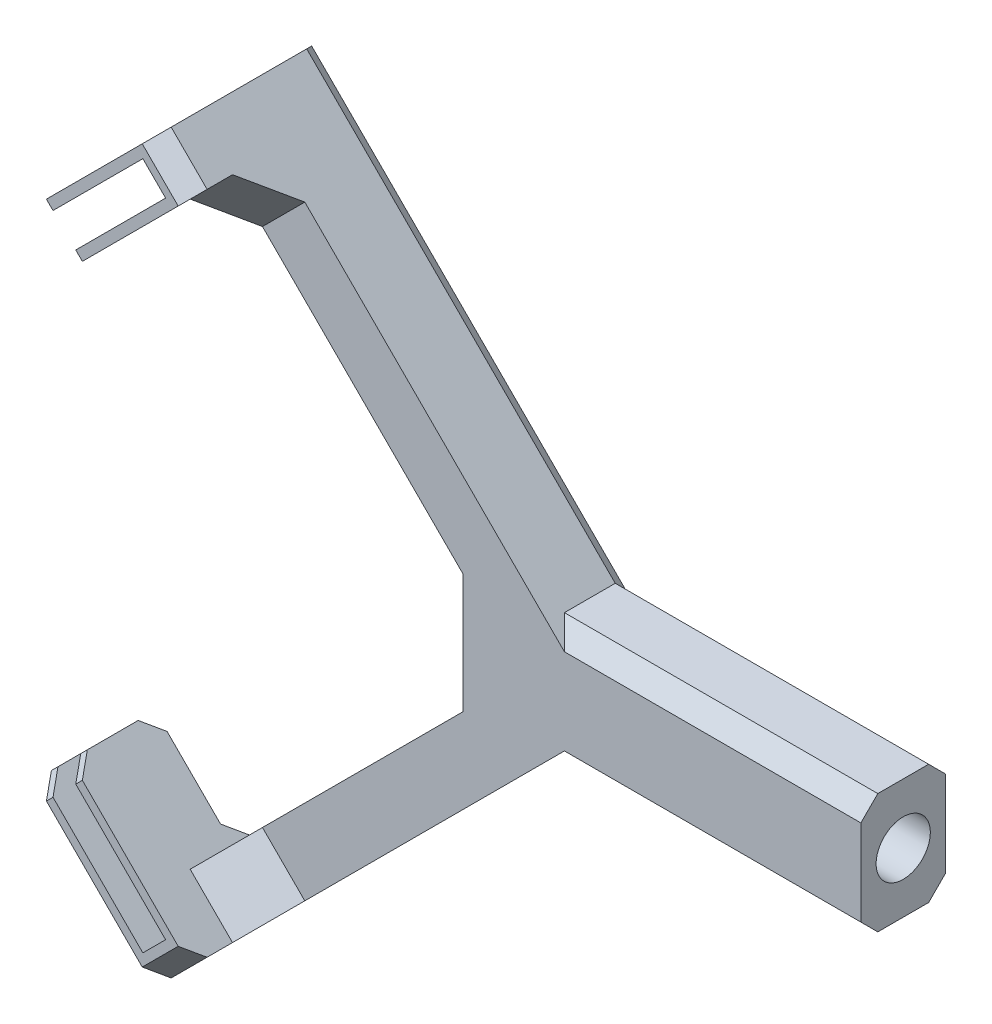
from build123d import *

# Parameters (mm, degrees)
EXTRUDE_1_DEPTH          = 5
CHAMFER_1_SIZE           = 10
CUT_EXTRUDE_1_DEPTH      = 61.279402969
CUT_EXTRUDE_1_DEPTH_BACK = 61.279402969
SKETCH_2_R               = 2.1
EXTRUDE_START            = 37
SKETCH_3_W               = 10
SKETCH_3_H               = 14.142135624
SKETCH_3_R               = 2.1
EXTRUDE_2_DEPTH          = 37
SKETCH_4_W               = 10
SKETCH_4_H               = 20
EXTRUDE_3_DEPTH          = 6
SKETCH_6_W               = 10
SKETCH_6_H               = 32
EXTRUDE_5_DEPTH          = 6
CUT_EXTRUDE_2_DEPTH      = 15
CUT_EXTRUDE_3_DEPTH      = 72.219678224
SKETCH_10_W              = 15
SKETCH_10_H              = 3.8
EXTRUDE_6_DEPTH          = 3
CHAMFER_2_SIZE           = 2
CHAMFER_3_SIZE           = 2
CHAMFER_4_SIZE           = 5
CHAMFER_5_SIZE           = 2
SKETCH_12_R              = 3.2
CUT_EXTRUDE_4_DEPTH      = 38
CUT_EXTRUDE_5_DEPTH      = 4


with BuildPart() as part:
    # 草图1 → 凸台-拉伸1 (new, symmetric)
    with BuildSketch(Plane.XY):
        Polygon((-10, 0), (33.5, 43.5), (38.5, 38.5), (0, 0), (38.5, -38.5), (33.5, -43.5), align=None)
    extrude(amount=EXTRUDE_1_DEPTH, both=True)

    # 倒角1
    chamfer_1_edges = [part.edges().sort_by_distance(p)[0] for p in [
        (-10, 0, 0),
        (0, 0, 0),
    ]]
    chamfer(chamfer_1_edges, length=CHAMFER_1_SIZE)

    # 草图2 → 切除-拉伸1 (cut, two sides: drawn at the far end of the back side and taken through both)
    with BuildSketch(Plane.ZY.offset(2.928932188).offset(-CUT_EXTRUDE_1_DEPTH_BACK)):
        with Locations(Location((0, 0, 0), (0, 0, 270))):
            Circle(SKETCH_2_R)
    extrude(amount=CUT_EXTRUDE_1_DEPTH + CUT_EXTRUDE_1_DEPTH_BACK, mode=Mode.SUBTRACT)

    # 草图3 → 凸台-拉伸2 (add)
    with BuildSketch(Plane.ZY.offset(2.928932188).offset(EXTRUDE_START)):
        Rectangle(SKETCH_3_W, SKETCH_3_H)
        with Locations(Location((0, 0, 0), (0, 0, 270))):
            Circle(SKETCH_3_R, mode=Mode.SUBTRACT)
    extrude(amount=-EXTRUDE_2_DEPTH)

    # 草图4 → 凸台-拉伸3 (add)
    with BuildSketch(Plane(origin=(38.5, 38.5, 0), x_dir=(0, 0, -1), z_dir=(0.7071067811865467, 0.7071067811865485, 0))):
        with Locations((-10, -2.928932188)):
            Rectangle(SKETCH_4_W, SKETCH_4_H)
    extrude_3 = extrude(amount=-EXTRUDE_3_DEPTH)

    # 草图6 → 凸台-拉伸5 (add)
    with BuildSketch(Plane(origin=(38.5, 38.5, 0), x_dir=(0, 0, -1), z_dir=(0.7071067811865467, 0.7071067811865485, 0))):
        with Locations((-10, 3.071067812)):
            Rectangle(SKETCH_6_W, SKETCH_6_H)
    extrude_5 = extrude(amount=-EXTRUDE_5_DEPTH)

    # 草图8 → 切除-拉伸2 (cut)
    with BuildSketch(Plane.XY.offset(15)):
        Polygon((21.549895398, 48.520458146), (44.177312396, 25.893041148), (46.864318164, 28.580046917), (24.236901166, 51.207463915), align=None)
    cut_extrude_2 = extrude(amount=-CUT_EXTRUDE_2_DEPTH, mode=Mode.SUBTRACT)

    # 草图9 → 切除-拉伸3 (cut, through all)
    with BuildSketch(Plane(origin=(0, 0, 5), x_dir=(-1, 0, 0), z_dir=(0, 0, -1))):
        Polygon((-32.722182541, 42.722182541), (-24.236901166, 51.207463915), (-25.014718626, 51.985281374), (-33.5, 43.5), align=None)
        Polygon((-21.549895398, 48.520458146), (-30.035176772, 40.035176772), (-29.257359313, 39.257359313), (-20.772077939, 47.742640687), align=None)
    cut_extrude_3 = extrude(amount=-CUT_EXTRUDE_3_DEPTH, mode=Mode.SUBTRACT)

    # 草图10 → 凸台-拉伸6 (add)
    with BuildSketch(Plane(origin=(-5, 5, 0), x_dir=(0, 0, 1), z_dir=(-0.7071067811865487, 0.7071067811865465, 0))):
        with Locations((7.5, 51.447222151)):
            Rectangle(SKETCH_10_W, SKETCH_10_H)
    extrude_6 = extrude(amount=-EXTRUDE_6_DEPTH)

    # 倒角2
    chamfer_2_edges = [part.edges().sort_by_distance(p)[0] for p in [
        (47.253226894, 28.968955647, 15),
        (31.378679656, 41.378679656, 15),
        (22.785533906, 22.785533906, -5),
        (43.788403666, 25.504132419, 5),
        (43.788403666, 25.504132419, 15),
        (15.285533906, 25.285533906, -5),
        (38.11109127, 38.11109127, 5),
        (47.253226894, 28.968955647, 5),
    ]]
    chamfer(chamfer_2_edges, length=CHAMFER_2_SIZE)

    # 镜向1: 凸台-拉伸3, 凸台-拉伸5, 切除-拉伸2, 切除-拉伸3, 凸台-拉伸6 across plane
    add(extrude_3.mirror(Plane.ZX))
    add(extrude_5.mirror(Plane.ZX))
    add(cut_extrude_2.mirror(Plane.ZX), mode=Mode.SUBTRACT)
    add(cut_extrude_3.mirror(Plane.ZX), mode=Mode.SUBTRACT)
    add(extrude_6.mirror(Plane.ZX))

    # 倒角3
    chamfer_3_edges = [part.edges().sort_by_distance(p)[0] for p in [
        (38.11109127, -38.11109127, 5),
        (15.285533906, -25.285533906, -5),
        (43.788403666, -25.504132419, 5),
        (43.788403666, -25.504132419, 15),
        (34.646268043, -34.646268043, 5),
        (47.253226894, -28.968955647, 5),
        (47.253226894, -28.968955647, 15),
        (31.378679656, -41.378679656, 15),
        (22.785533906, -22.785533906, -5),
    ]]
    chamfer(chamfer_3_edges, length=CHAMFER_3_SIZE)

    # 倒角4
    chamfer_4_edges = [part.edges().sort_by_distance(p)[0] for p in [
        (31.757359313, -36.757359313, 5),
        (31.757359313, 36.757359313, 5),
    ]]
    chamfer(chamfer_4_edges, length=CHAMFER_4_SIZE)

    # 倒角5
    chamfer_5_edges = [part.edges().sort_by_distance(p)[0] for p in [
        (-20.014718626, -7.071067812, -5),
        (-20.014718626, 7.071067812, -5),
        (-21.428932188, -7.071067812, 5),
        (-21.428932188, 7.071067812, 5),
    ]]
    chamfer(chamfer_5_edges, length=CHAMFER_5_SIZE)

    # 草图12 → 切除-拉伸4 (cut)
    with BuildSketch(Plane.ZY.offset(39.928932188)):
        with Locations(Location((0, 0, 0), (0, 0, 270))):
            Circle(SKETCH_12_R)
    extrude(amount=-CUT_EXTRUDE_4_DEPTH, mode=Mode.SUBTRACT)

    # 草图13 → 切除-拉伸5 (cut)
    with BuildSketch(Plane(origin=(7.071067812, 0, 0), x_dir=(0, 0, -1), z_dir=(1, 0, 0))):
        Polygon((2.107328483, -3.65), (4.214656965, 0), (2.107328483, 3.65), (-2.107328483, 3.65), (-4.214656965, 0), (-2.107328483, -3.65), align=None)
    extrude(amount=-CUT_EXTRUDE_5_DEPTH, mode=Mode.SUBTRACT)


with BuildPart() as body_2:
    # 镜向2: mirrored copy
    add(part.part.mirror(Plane.ZY.offset(39.928932188)))


solid = body_2.part
